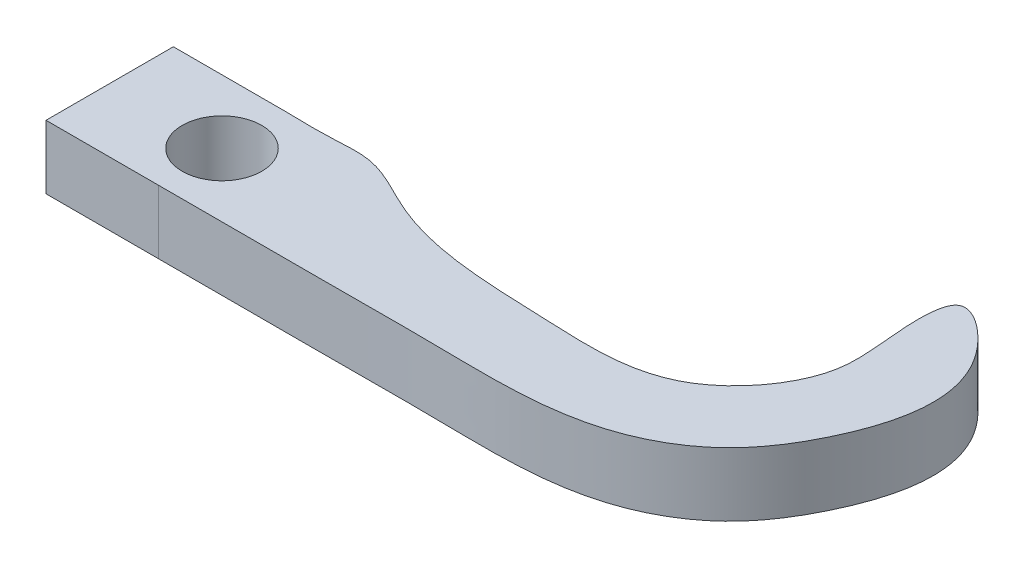
from build123d import *

# Parameters (mm, degrees)
SKETCH_1_R      = 2.5
EXTRUDE_1_DEPTH = 4


with BuildPart() as part:
    # 草图1 → 凸台-拉伸1 (new body)
    with BuildSketch(Plane(origin=(0, 0, 0), x_dir=(1, 0, 0), z_dir=(0, 1, 0))):
        with BuildLine():
            Line((0, 4), (-7.053226721, 4))
            Line((-7.053226721, 4), (-7.053226721, -4))
            Line((-7.053226721, -4), (0, -4))
            add(Edge.make_bspline(
                [(0, 4), (0.965154346, 3.977929644), (2.676269001, 3.938801281), (5.748338444, 4.235126774), (10.798431477, 1.043030736), (18.418931225, 0.983332766), (27.406316073, 0.415105224), (31.84858475, 6.509563853), (31.178499136, 10.599047714), (31.009410861, 15.920252437), (37.308449713, 11.216306153), (35.804997008, 4.567240953), (32.411147935, -0.650692495), (26.467056561, -4.263964233), (18.860342625, -3.941798085), (11.643098952, -4.00660071), (5.807422496, -3.997645445), (2.235791853, -3.999093523), (0, -4)],
                knots=[0, 0, 0, 0, 0.031523028, 0.055886932, 0.098002445, 0.216060448, 0.302293822, 0.373418373, 0.416617427, 0.454314908, 0.488952601, 0.591586624, 0.647126474, 0.69045915, 0.810546038, 0.883818874, 0.927272207, 1, 1, 1, 1], degree=3))
        make_face()
        with Locations(Location((0, 0, 0), (0, 0, 270))):
            Circle(SKETCH_1_R, mode=Mode.SUBTRACT)
    extrude(amount=EXTRUDE_1_DEPTH)


solid = part.part
